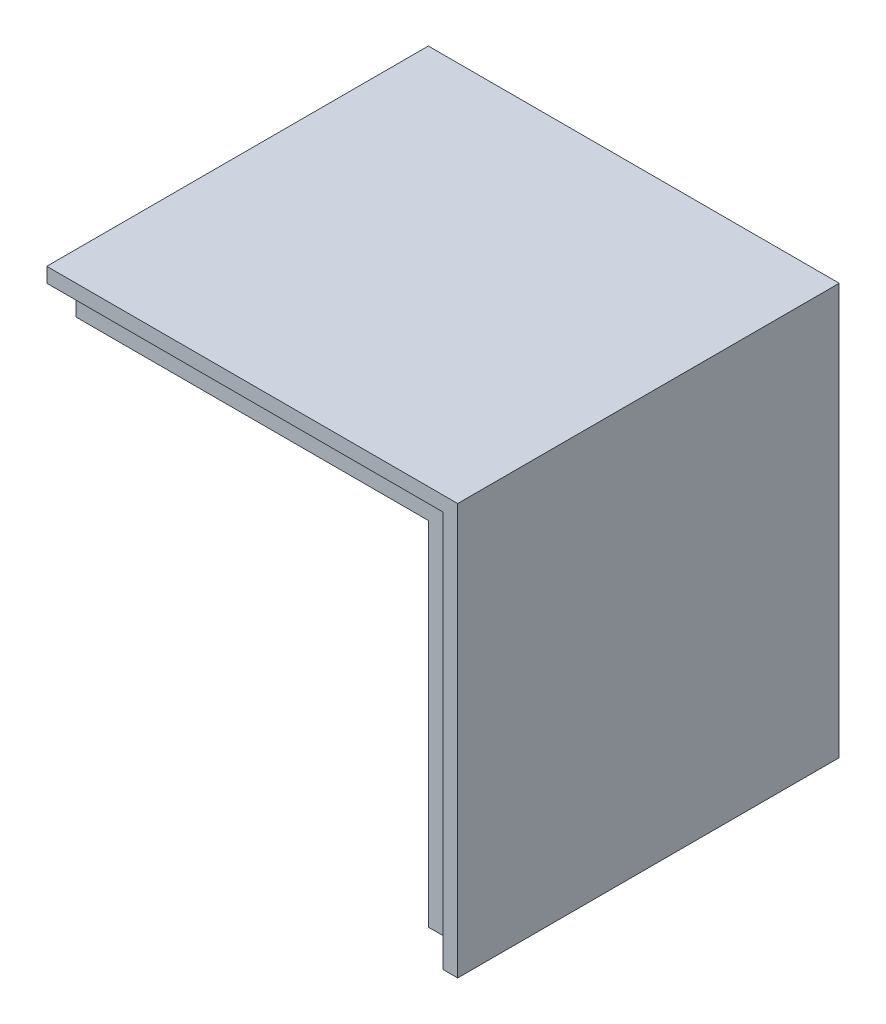
from build123d import *

# Parameters (mm, degrees)
SALIENTE_EXTRUIR1_DEPTH = 65
SALIENTE_EXTRUIR2_DEPTH = 60


with BuildPart() as part:
    # Croquis1 → Saliente-Extruir1 (new, symmetric)
    with BuildSketch(Plane.XY):
        Polygon((-70, 72.5), (70, 72.5), (70, -67.5), (65, -67.5), (65, 67.5), (-70, 67.5), align=None)
    extrude(amount=SALIENTE_EXTRUIR1_DEPTH, both=True)

    # Croquis2 → Saliente-Extruir2 (add, symmetric)
    with BuildSketch(Plane.XY):
        Polygon((-65, 67.5), (-65, 57.5), (55, 57.5), (55, -62.5), (65, -62.5), (65, 67.5), align=None)
    extrude(amount=SALIENTE_EXTRUIR2_DEPTH, both=True)


solid = part.part
